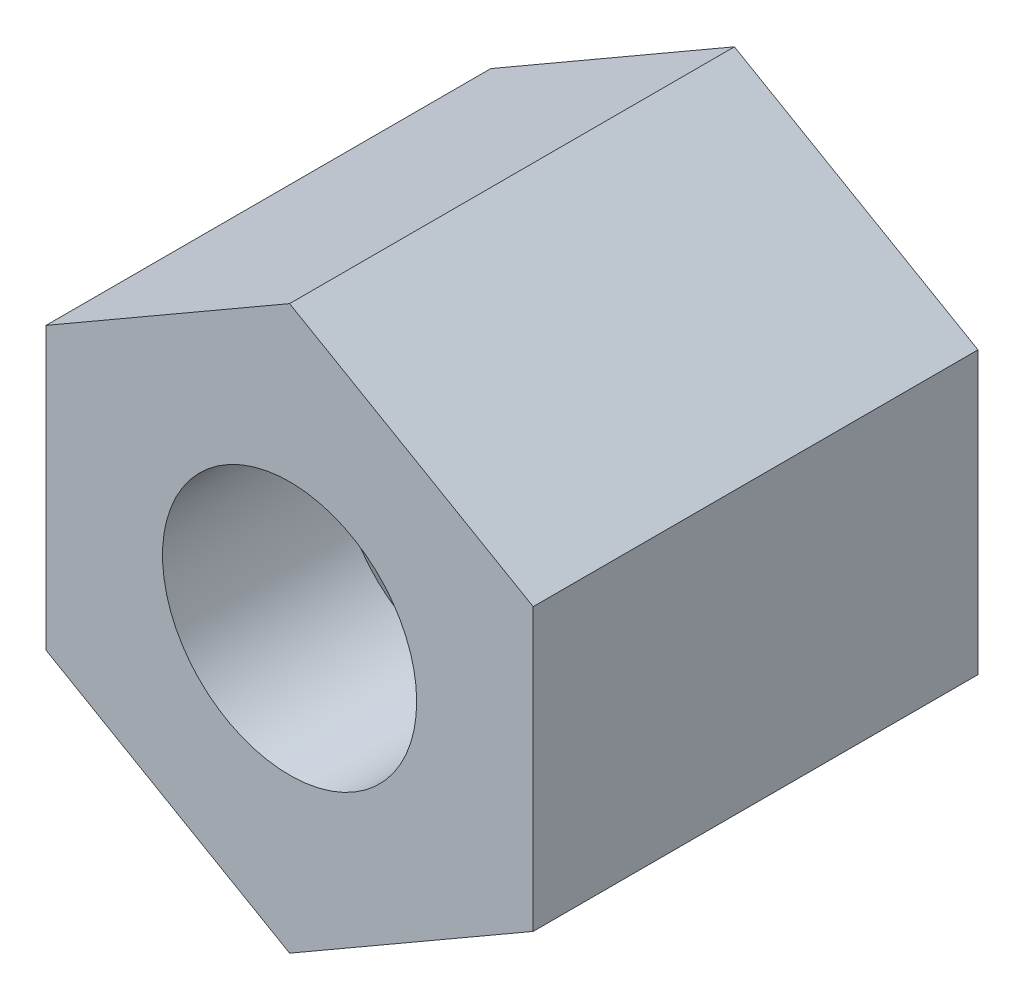
from build123d import *

# Parameters (mm, degrees)
EXTRUDE_1_DEPTH     = 42
SKETCH_12_R         = 15
CUT_EXTRUDE_3_DEPTH = 20
SKETCH_16_R         = 15
CUT_EXTRUDE_6_DEPTH = 4
CUT_EXTRUDE_6_DRAFT = -25
SKETCH_17_R         = 13.134769367
CUT_EXTRUDE_7_DEPTH = 2
CUT_EXTRUDE_7_DRAFT = -40
SKETCH_18_R         = 12
CUT_EXTRUDE_8_DEPTH = 18


with BuildPart() as part:
    # 草图2 → 拉伸1 (new body)
    with BuildSketch(Plane.XY):
        Polygon((0, 26.558112383), (-23, 13.279056191), (-23, -13.279056191), (0, -26.558112383), (23, -13.279056191), (23, 13.279056191), align=None)
    extrude(amount=EXTRUDE_1_DEPTH)

    # 草图12 → 拉伸3 (cut)
    with BuildSketch(Plane(origin=(0, 0, 0), x_dir=(-1, 0, 0), z_dir=(0, 0, -1))):
        Circle(SKETCH_12_R)
    extrude(amount=-CUT_EXTRUDE_3_DEPTH, mode=Mode.SUBTRACT)


with BuildPart() as cut_extrude_6_tool:
    # 草图16 → 拉伸6 (with draft: the straight prism first)
    with BuildSketch(Plane(origin=(0, 0, 20), x_dir=(-1, 0, 0), z_dir=(0, 0, -1))):
        Circle(SKETCH_16_R)
    extrude(amount=-CUT_EXTRUDE_6_DEPTH)
    # 拉伸6: the draft: its side faces are tilted about the plane it starts from
    cut_extrude_6_sides = [cut_extrude_6_tool.faces().sort_by_distance(p)[0] for p in [
        (15, 0, 22),
    ]]
    draft(cut_extrude_6_sides, Plane(origin=(0, 0, 20), x_dir=(-1, 0, 0), z_dir=(0, 0, -1)), CUT_EXTRUDE_6_DRAFT)


with BuildPart() as part_1:
    add(part.part)

    # 拉伸6: cut by cut_extrude_6_tool
    add(cut_extrude_6_tool.part, mode=Mode.SUBTRACT)


with BuildPart() as cut_extrude_7_tool:
    # 草图17 → 拉伸7 (with draft: the straight prism first)
    with BuildSketch(Plane(origin=(0, 0, 24), x_dir=(-1, 0, 0), z_dir=(0, 0, -1))):
        Circle(SKETCH_17_R)
    extrude(amount=-CUT_EXTRUDE_7_DEPTH)
    # 拉伸7: the draft: its side faces are tilted about the plane it starts from
    cut_extrude_7_sides = [cut_extrude_7_tool.faces().sort_by_distance(p)[0] for p in [
        (13.134769367, 0, 25),
    ]]
    draft(cut_extrude_7_sides, Plane(origin=(0, 0, 24), x_dir=(-1, 0, 0), z_dir=(0, 0, -1)), CUT_EXTRUDE_7_DRAFT)


with BuildPart() as part_2:
    add(part_1.part)

    # 拉伸7: cut by cut_extrude_7_tool
    add(cut_extrude_7_tool.part, mode=Mode.SUBTRACT)

    # 草图18 → 拉伸8 (cut)
    with BuildSketch(Plane.XY.offset(42)):
        Circle(SKETCH_18_R)
    extrude(amount=-CUT_EXTRUDE_8_DEPTH, mode=Mode.SUBTRACT)


solid = part_2.part
